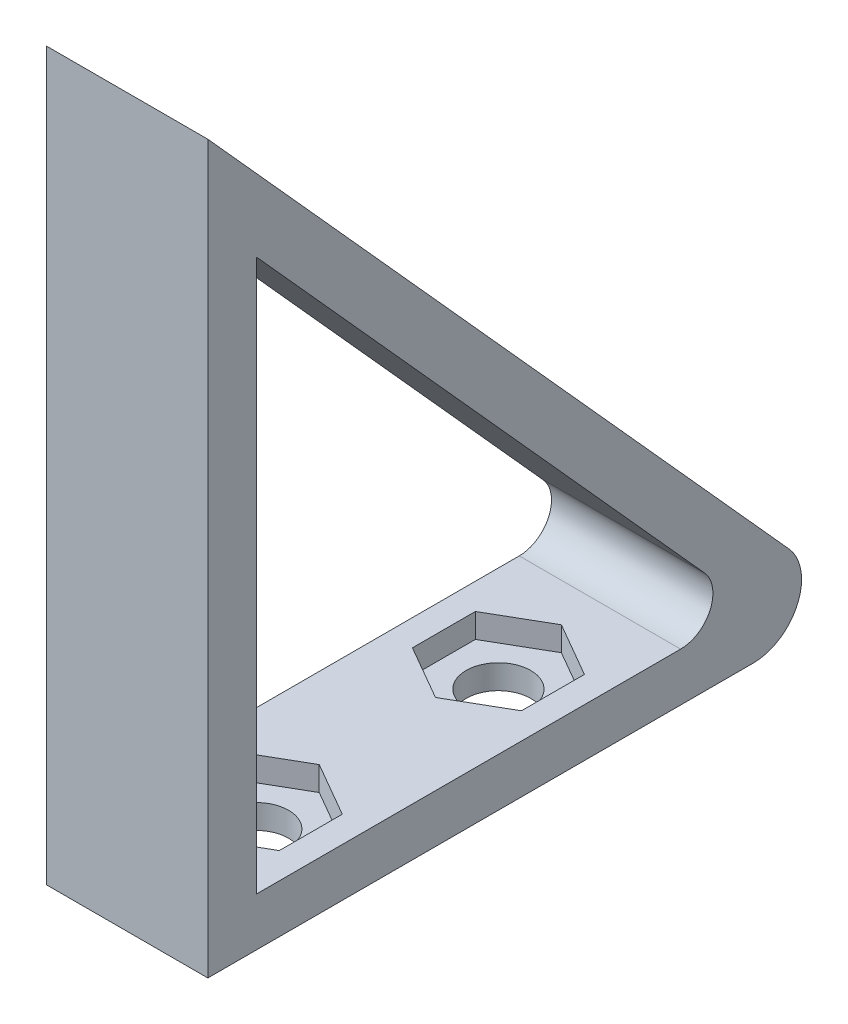
from build123d import *

# Parameters (mm, degrees)
BOSS_EXTRUDE1_DEPTH = 10
CUT_EXTRUDE1_DEPTH  = 62.373634991
SKETCH3_R           = 2
CUT_EXTRUDE2_DEPTH  = 3
CUT_EXTRUDE3_DEPTH  = 1.5
FILLET1_R           = 3
FILLET2_R           = 2


with BuildPart() as part:
    # Sketch1 → Boss-Extrude1 (new body)
    with BuildSketch(Plane(origin=(0, 0, 0), x_dir=(0, 0, -1), z_dir=(1, 0, 0))):
        Polygon((0, 0), (0, 45), (40.518181993, 0), align=None)
    extrude(amount=-BOSS_EXTRUDE1_DEPTH)

    # Sketch2 → Cut-Extrude1 (cut, through all)
    with BuildSketch(Plane(origin=(0, 0, 0), x_dir=(0, 0, -1), z_dir=(1, 0, 0))):
        Polygon((33.780071672, 3), (3, 37.184732806), (3, 3), align=None)
    extrude(amount=-CUT_EXTRUDE1_DEPTH, mode=Mode.SUBTRACT)

    # Sketch3 → Cut-Extrude2 (cut)
    with BuildSketch(Plane.XZ):
        with Locations(Location((-5, -8, 0), (0, 0, 270))):
            Circle(SKETCH3_R)
        with Locations(Location((-5, -23, 0), (0, 0, 270))):
            Circle(SKETCH3_R)
    extrude(amount=-CUT_EXTRUDE2_DEPTH, mode=Mode.SUBTRACT)

    # Sketch4 → Cut-Extrude3 (cut)
    with BuildSketch(Plane(origin=(0, 3, 0), x_dir=(1, 0, 0), z_dir=(0, 1, 0))):
        Polygon((-5, 19.1), (-1.622500925, 21.05), (-1.622500925, 24.95), (-5, 26.9), (-8.377499075, 24.95), (-8.377499075, 21.05), align=None)
        Polygon((-5, 11.9), (-8.377499075, 9.95), (-8.377499075, 6.05), (-5, 4.1), (-1.622500925, 6.05), (-1.622500925, 9.95), align=None)
    extrude(amount=-CUT_EXTRUDE3_DEPTH, mode=Mode.SUBTRACT)

    # Fillet1
    fillet1_edges = [part.edges().sort_by_distance(p)[0] for p in [
        (-5, 0, -40.518181993),
    ]]
    fillet(fillet1_edges, radius=FILLET1_R)

    # Fillet2
    fillet2_edges = [part.edges().sort_by_distance(p)[0] for p in [
        (-5, 3, -33.780071672),
    ]]
    fillet(fillet2_edges, radius=FILLET2_R)


solid = part.part
